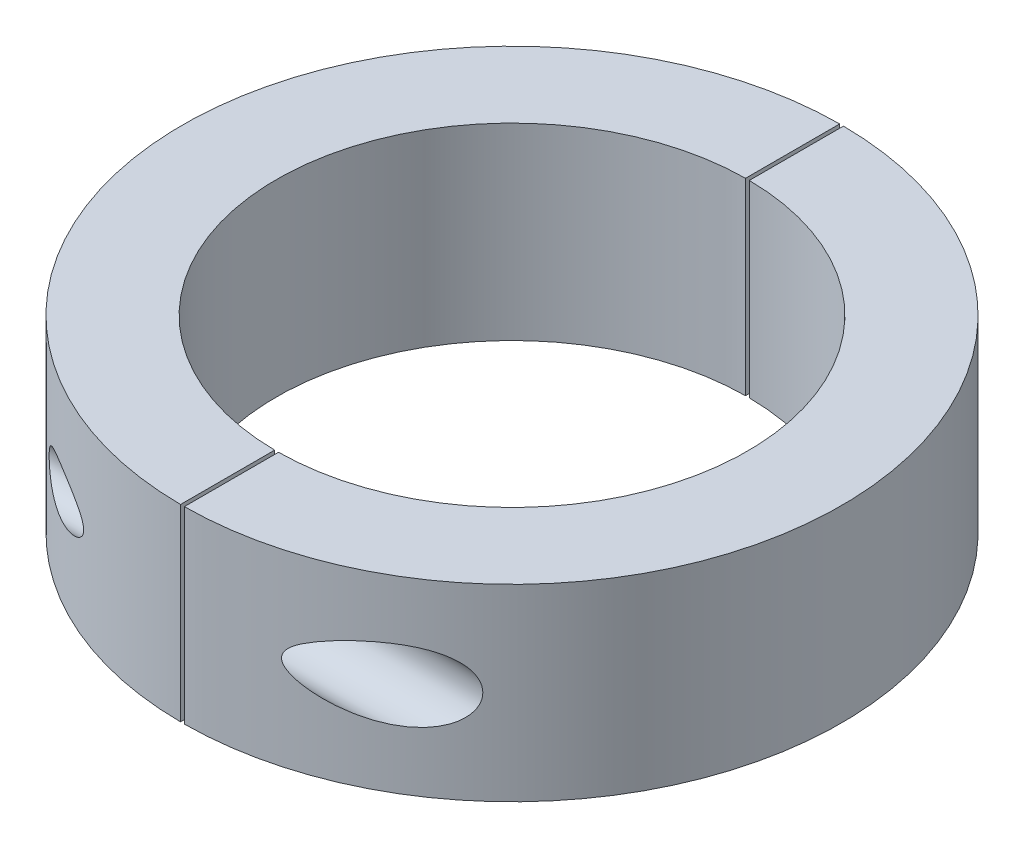
from build123d import *

# Parameters (mm, degrees)
SKETCH1_R           = 44.45
SKETCH1_R_2         = 31.75
BOSS_EXTRUDE1_DEPTH = 25.4
SKETCH2_W           = 0.508
SKETCH2_H           = 94.561041641
CUT_EXTRUDE1_DEPTH  = 25.4
SKETCH3_R           = 3.175
CUT_EXTRUDE2_DEPTH  = 29.21
CUT_EXTRUDE3_START  = 6.35
SKETCH4_R           = 4.7625
CUT_EXTRUDE3_DEPTH  = 77.47


with BuildPart() as part:
    # Sketch1 → Boss-Extrude1 (new body)
    with BuildSketch(Plane(origin=(0, 0, 0), x_dir=(1, 0, 0), z_dir=(0, 1, 0))):
        with Locations(Location((0, 0, 0), (0, 0, 270))):
            Circle(SKETCH1_R)
        with Locations(Location((0, 0, 0), (0, 0, 270))):
            Circle(SKETCH1_R_2, mode=Mode.SUBTRACT)
    extrude(amount=BOSS_EXTRUDE1_DEPTH)

    # Sketch2 → Cut-Extrude1 (cut)
    with BuildSketch(Plane(origin=(0, 25.4, 0), x_dir=(1, 0, 0), z_dir=(0, 1, 0))):
        with Locations((0, -0.808982296)):
            Rectangle(SKETCH2_W, SKETCH2_H)
    extrude(amount=-CUT_EXTRUDE1_DEPTH, mode=Mode.SUBTRACT)


with BuildPart() as cut_extrude1_piece_1:
    # of the separate pieces the step leaves, piece 1, a body of its own (cut_extrude1_pieces)
    add(part.part.solids().sort_by_distance((-0.254, 0, -44.44927428))[0])


with BuildPart() as cut_extrude1_piece_2:
    # of the separate pieces the step leaves, piece 2, a body of its own (cut_extrude1_pieces)
    add(part.part.solids().sort_by_distance((0.254, 0, 44.44927428))[0])


with BuildPart() as cut_extrude2_tool:
    # Sketch3 → Cut-Extrude2 (new, symmetric)
    with BuildSketch(Plane(origin=(-0.254, 0, 0), x_dir=(0, 0, -1), z_dir=(1, 0, 0))):
        with Locations((38.09927428, 12.7)):
            Circle(SKETCH3_R)
        with Locations((-38.09927428, 12.7)):
            Circle(SKETCH3_R)
    extrude(amount=CUT_EXTRUDE2_DEPTH, both=True)


with BuildPart() as cut_extrude1_piece_1_1:
    add(cut_extrude1_piece_1.part)

    # Cut-Extrude2: cut by cut_extrude2_tool
    add(cut_extrude2_tool.part, mode=Mode.SUBTRACT)


with BuildPart() as cut_extrude1_piece_2_1:
    add(cut_extrude1_piece_2.part)

    # Cut-Extrude2: cut by cut_extrude2_tool
    add(cut_extrude2_tool.part, mode=Mode.SUBTRACT)

    # Sketch4 → Cut-Extrude3 (cut)
    with BuildSketch(Plane(origin=(0, 0, 0), x_dir=(0, 0, -1), z_dir=(1, 0, 0)).offset(CUT_EXTRUDE3_START)):
        with Locations(Location((38.09927428, 12.7, 0), (0, 0, 180))):
            Circle(SKETCH4_R)
        with Locations(Location((-38.09927428, 12.7, 0), (0, 0, 180))):
            Circle(SKETCH4_R)
    extrude(amount=CUT_EXTRUDE3_DEPTH, mode=Mode.SUBTRACT)


solid = Compound([cut_extrude1_piece_1_1.part, cut_extrude1_piece_2_1.part])
